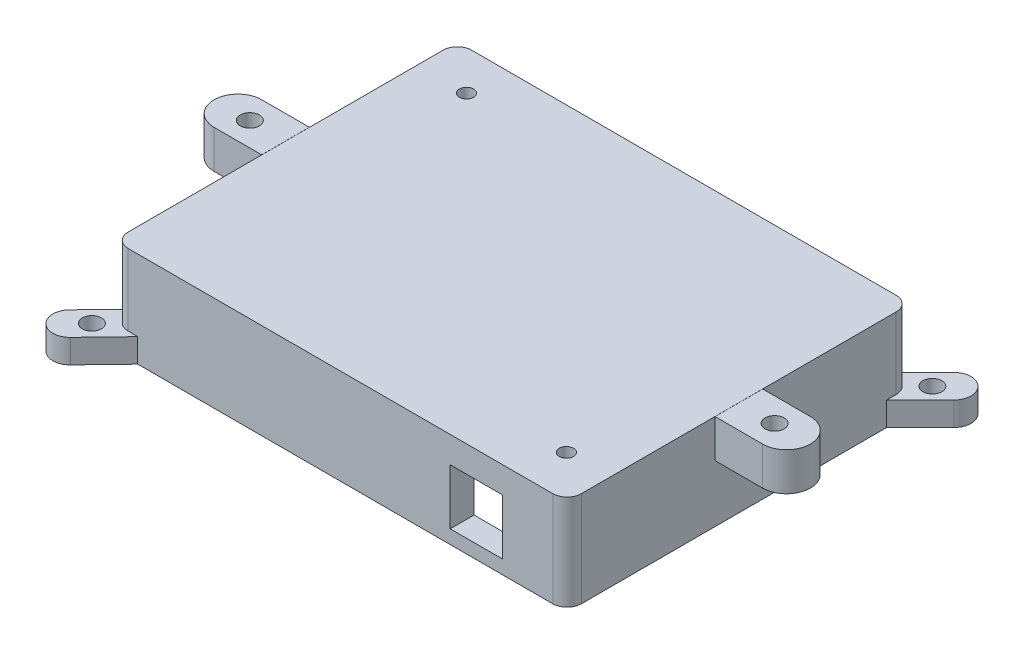
from build123d import *

# Parameters (mm, degrees)
RESSALTO_EXTRUS_O2_DEPTH   = 20
CORTE_EXTRUS_O1_START      = -20
ESBO_O5_W                  = 85
ESBO_O5_H                  = 62
CORTE_EXTRUS_O1_DEPTH      = 15
CORTE_EXTRUS_O2_REACH      = 112.192
ESBO_O6_W                  = 11
ESBO_O6_H                  = 11.63
ESBO_O8_R                  = 2
RESSALTO_EXTRUS_O5_DEPTH   = 5
ESBO_O7_R                  = 2
RESSALTO_EXTRUS_O6_DEPTH   = 8
RESSALTO_EXTRUS_O6_2_DEPTH = 8
ESBO_O9_R                  = 1.5
CORTE_EXTRUS_O3_DEPTH      = 115.124294054


with BuildPart() as part:
    # Esboço1 → Ressalto-extrusão2 (new body)
    with BuildSketch(Plane(origin=(0, 0, 0), x_dir=(1, 0, 0), z_dir=(0, 1, 0))):
        with BuildLine():
            Line((-77.983264016, 51.781356356), (11.016735984, 51.781356356))
            ThreePointArc((11.016735984, 51.781356356), (13.138056327, 50.902676699), (14.016735984, 48.781356356))
            Line((14.016735984, 48.781356356), (14.016735984, -17.218643644))
            ThreePointArc((14.016735984, -17.218643644), (13.138056327, -19.339963988), (11.016735984, -20.218643644))
            Line((11.016735984, -20.218643644), (-77.983264016, -20.218643644))
            ThreePointArc((-77.983264016, -20.218643644), (-80.10458436, -19.339963988), (-80.983264016, -17.218643644))
            Line((-80.983264016, -17.218643644), (-80.983264016, 48.781356356))
            ThreePointArc((-80.983264016, 48.781356356), (-80.10458436, 50.902676699), (-77.983264016, 51.781356356))
        make_face()
    extrude(amount=RESSALTO_EXTRUS_O2_DEPTH)

    # Esboço5 → Corte-extrusão1 (cut)
    with BuildSketch(Plane(origin=(0, 20, 0), x_dir=(1, 0, 0), z_dir=(0, 1, 0)).offset(CORTE_EXTRUS_O1_START)):
        with Locations((-33.483264016, 15.781356356)):
            Rectangle(ESBO_O5_W, ESBO_O5_H)
    extrude(amount=CORTE_EXTRUS_O1_DEPTH, mode=Mode.SUBTRACT)

    # Esboço6 → Corte-extrusão2 (cut, up to next)
    with BuildSketch(Plane.XY.offset(20.218643644), mode=Mode.PRIVATE) as corte_extrus_o2_sk1:
        with Locations((-4.983264016, 8.675)):
            Rectangle(ESBO_O6_W, ESBO_O6_H)
    corte_extrus_o2_tool1 = extrude(corte_extrus_o2_sk1.sketch, amount=-CORTE_EXTRUS_O2_REACH, mode=Mode.PRIVATE) & part.part
    add(corte_extrus_o2_tool1.solids().sort_by_distance((-4.983264, 8.675, 20.218644))[0], mode=Mode.SUBTRACT)

    # Esboço8 → Ressalto-extrusão5 (add)
    # profile 1 of 2: a face of its own
    with BuildSketch(Plane.XZ):
        with BuildLine():
            Line((9.016735984, -51.781356356), (14.016735984, -46.781356356))
            Line((14.016735984, -46.781356356), (21.087803796, -53.852424167))
            ThreePointArc((21.087803796, -53.852424167), (21.087803796, -58.852424167), (16.087803796, -58.852424167))
            Line((16.087803796, -58.852424167), (9.016735984, -51.781356356))
        make_face()
        with Locations(Location((16.30226989, -54.066890262, 0), (0, 0, 270))):
            Circle(ESBO_O8_R, mode=Mode.SUBTRACT)
    # profile 2 of 2: a face of its own
    with BuildSketch(Plane.XZ):
        with BuildLine():
            Line((-75.983264016, 20.218643644), (-81.074651757, 15.313501326))
            Line((-81.074651757, 15.313501326), (-88.012774398, 22.515060478))
            ThreePointArc((-88.012774398, 22.515060478), (-87.919651687, 27.513325508), (-82.921386657, 27.420202797))
            Line((-82.921386657, 27.420202797), (-75.983264016, 20.218643644))
        make_face()
        with Locations(Location((-83.201457851, 22.615984576, 0), (0, 0, 270))):
            Circle(ESBO_O8_R, mode=Mode.SUBTRACT)
    extrude(amount=-RESSALTO_EXTRUS_O5_DEPTH)

    # Esboço9 → Corte-extrusão3 (cut, through all)
    with BuildSketch(Plane.XZ.offset(-15)):
        with Locations(Location((-70.733264016, -43.441356356, 0), (0, 0, 270))):
            Circle(ESBO_O9_R)
        with Locations(Location((4.956735984, 11.298643644, 0), (0, 0, 270))):
            Circle(ESBO_O9_R)
    extrude(amount=-CORTE_EXTRUS_O3_DEPTH, mode=Mode.SUBTRACT)


with BuildPart() as body_2:
    # Esboço7 → Ressalto-extrusão6 (new body)
    with BuildSketch(Plane(origin=(0, 20, 0), x_dir=(1, 0, 0), z_dir=(0, 1, 0))):
        with BuildLine():
            ThreePointArc((-90.983264016, 10.781356356), (-95.983264016, 15.781356356), (-90.983264016, 20.781356356))
            Line((-90.983264016, 20.781356356), (-81.005988355, 20.781356356))
            Line((-81.005988355, 20.781356356), (-81.005988355, 10.781356356))
            Line((-81.005988355, 10.781356356), (-90.983264016, 10.781356356))
        make_face()
        with Locations(Location((-88.483264016, 15.781356356, 0), (0, 0, 270))):
            Circle(ESBO_O7_R, mode=Mode.SUBTRACT)
    extrude(amount=-RESSALTO_EXTRUS_O6_DEPTH)


with BuildPart() as body_3:
    # Esboço7 → Ressalto-extrus_o6 2 (new body)
    with BuildSketch(Plane(origin=(0, 20, 0), x_dir=(1, 0, 0), z_dir=(0, 1, 0))):
        with BuildLine():
            Line((24.016735984, 10.781356356), (14.039460323, 10.781356356))
            Line((14.039460323, 10.781356356), (14.039460323, 20.781356356))
            Line((14.039460323, 20.781356356), (24.016735984, 20.781356356))
            ThreePointArc((24.016735984, 20.781356356), (29.016735984, 15.781356356), (24.016735984, 10.781356356))
        make_face()
        with Locations(Location((21.516735984, 15.781356356, 0), (0, 0, 270))):
            Circle(ESBO_O7_R, mode=Mode.SUBTRACT)
    extrude(amount=-RESSALTO_EXTRUS_O6_2_DEPTH)


solid = Compound([part.part, body_2.part, body_3.part])
